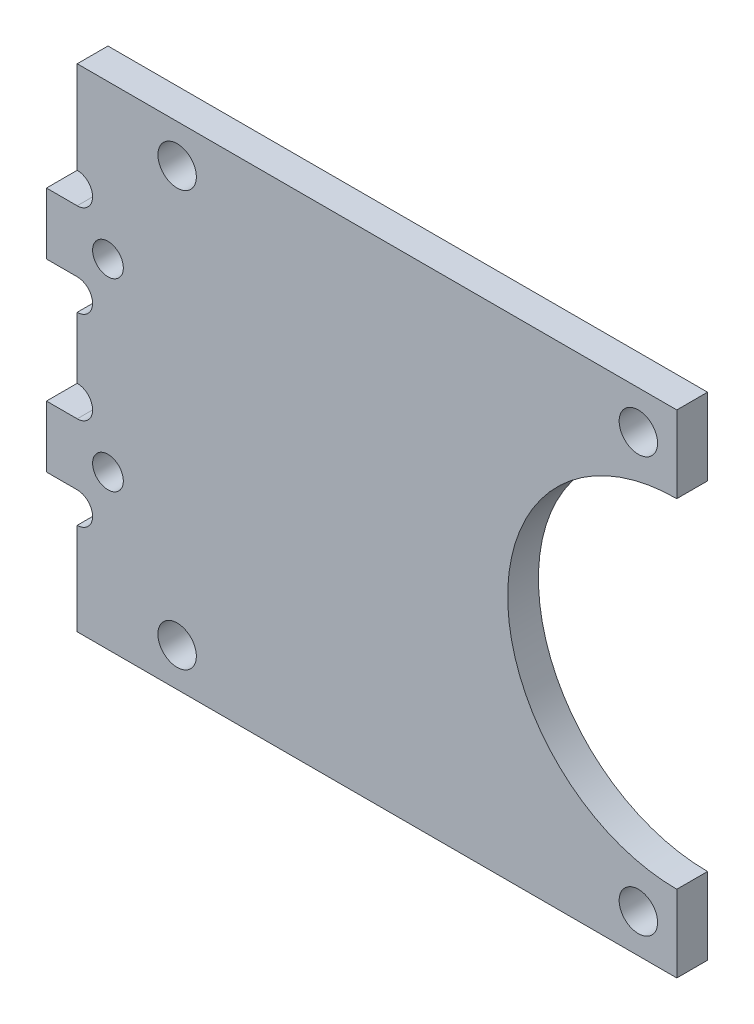
from build123d import *

# Parameters (mm, degrees)
SKETCH_1_R          = 1.25
SKETCH_1_R_2        = 1
EXTRUDE_1_DEPTH     = 2
CUT_EXTRUDE_1_DEPTH = 2


with BuildPart() as part:
    # 草圖1 → 填料-伸長1 (new body)
    with BuildSketch(Plane.XY):
        with BuildLine():
            Line((-17.216213198, 10.1625), (13.283786802, 10.1625))
            Line((13.283786802, 10.1625), (13.283786802, -21.8375))
            Line((13.283786802, -21.8375), (-17.216213198, -21.8375))
            Line((-17.216213198, -21.8375), (-19.716213198, -21.8375))
            Line((-19.716213198, -21.8375), (-25.716213198, -21.8375))
            Line((-25.716213198, -21.8375), (-25.716213198, -15.8375))
            ThreePointArc((-25.716213198, -15.8375), (-24.716213198, -14.8375), (-25.716213198, -13.8375))
            Line((-25.716213198, -13.8375), (-27.716213198, -13.8375))
            Line((-27.716213198, -13.8375), (-27.716213198, -9.8375))
            Line((-27.716213198, -9.8375), (-25.716213198, -9.8375))
            ThreePointArc((-25.716213198, -9.8375), (-24.716213198, -8.8375), (-25.716213198, -7.8375))
            Line((-25.716213198, -7.8375), (-25.716213198, -3.8375))
            ThreePointArc((-25.716213198, -3.8375), (-24.716213198, -2.8375), (-25.716213198, -1.8375))
            Line((-25.716213198, -1.8375), (-27.716213198, -1.8375))
            Line((-27.716213198, -1.8375), (-27.716213198, 2.1625))
            Line((-27.716213198, 2.1625), (-25.716213198, 2.1625))
            ThreePointArc((-25.716213198, 2.1625), (-24.716213198, 3.1625), (-25.716213198, 4.1625))
            Line((-25.716213198, 4.1625), (-25.716213198, 10.1625))
            Line((-25.716213198, 10.1625), (-21.716213198, 10.1625))
            Line((-21.716213198, 10.1625), (-17.216213198, 10.1625))
        make_face()
        with Locations((-19.216213198, 7.6625)):
            Circle(SKETCH_1_R, mode=Mode.SUBTRACT)
        with Locations((-19.216213198, -19.3375)):
            Circle(SKETCH_1_R, mode=Mode.SUBTRACT)
        with Locations((10.783786802, -19.3375)):
            Circle(SKETCH_1_R, mode=Mode.SUBTRACT)
        with Locations((10.783786802, 7.6625)):
            Circle(SKETCH_1_R, mode=Mode.SUBTRACT)
        with Locations((-23.716213198, -11.8375)):
            Circle(SKETCH_1_R_2, mode=Mode.SUBTRACT)
        with Locations((-23.716213198, 0.1625)):
            Circle(SKETCH_1_R_2, mode=Mode.SUBTRACT)
    extrude(amount=EXTRUDE_1_DEPTH)

    # 草圖4 → 除料-伸長1 (cut)
    with BuildSketch(Plane(origin=(0, 0, 0), x_dir=(-1, 0, 0), z_dir=(0, 0, -1))):
        with BuildLine():
            Line((-13.283786802, -16.8375), (-13.283786802, 5.1625))
            ThreePointArc((-13.283786802, 5.1625), (-2.283786802, -5.8375), (-13.283786802, -16.8375))
        make_face()
    extrude(amount=-CUT_EXTRUDE_1_DEPTH, mode=Mode.SUBTRACT)


solid = part.part
